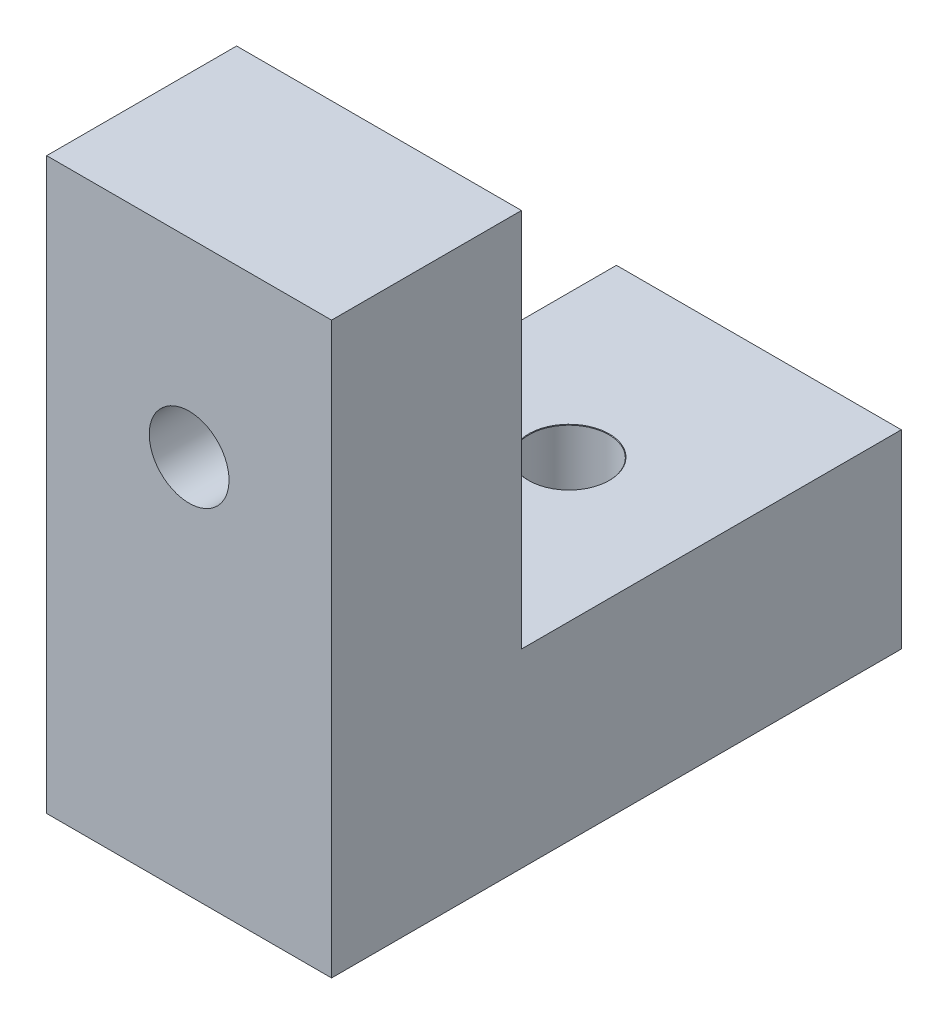
from build123d import *

# Parameters (mm, degrees)
BOSS_EXTRUDE2_DEPTH                   = 15
TAP_DRILL_FOR_M5X0_8_TAP3_D           = 4.2
TAP_DRILL_FOR_M5X0_8_TAP3_CSINK_D     = 4.25
TAP_DRILL_FOR_M5X0_8_TAP3_CSINK_ANGLE = 90
TAP_DRILL_FOR_M5X0_8_TAP4_D           = 4.2
TAP_DRILL_FOR_M5X0_8_TAP4_CSINK_D     = 4.25
TAP_DRILL_FOR_M5X0_8_TAP4_CSINK_ANGLE = 90


with BuildPart() as part:
    # Sketch8 → Boss-Extrude2 (new body)
    with BuildSketch(Plane(origin=(0, 0, 0), x_dir=(0, 0, -1), z_dir=(1, 0, 0))):
        Polygon((0, 30), (0, 0), (30, 0), (30, 10), (10, 10), (10, 30), align=None)
    extrude(amount=BOSS_EXTRUDE2_DEPTH)

    # Tap Drill for M5x0.8 Tap3 (through all)
    with Locations(Plane(origin=(0, 10, 0), x_dir=(1, 0, 0), z_dir=(0, 1, 0))):
        with Locations((7.5, 20)):
            CounterSinkHole(TAP_DRILL_FOR_M5X0_8_TAP3_D / 2, TAP_DRILL_FOR_M5X0_8_TAP3_CSINK_D / 2, counter_sink_angle=TAP_DRILL_FOR_M5X0_8_TAP3_CSINK_ANGLE)

    # Tap Drill for M5x0.8 Tap4 (through all)
    with Locations(Plane(origin=(0, 0, -10), x_dir=(-1, 0, 0), z_dir=(0, 0, -1))):
        with Locations((-7.5, 20)):
            CounterSinkHole(TAP_DRILL_FOR_M5X0_8_TAP4_D / 2, TAP_DRILL_FOR_M5X0_8_TAP4_CSINK_D / 2, counter_sink_angle=TAP_DRILL_FOR_M5X0_8_TAP4_CSINK_ANGLE)


solid = part.part
